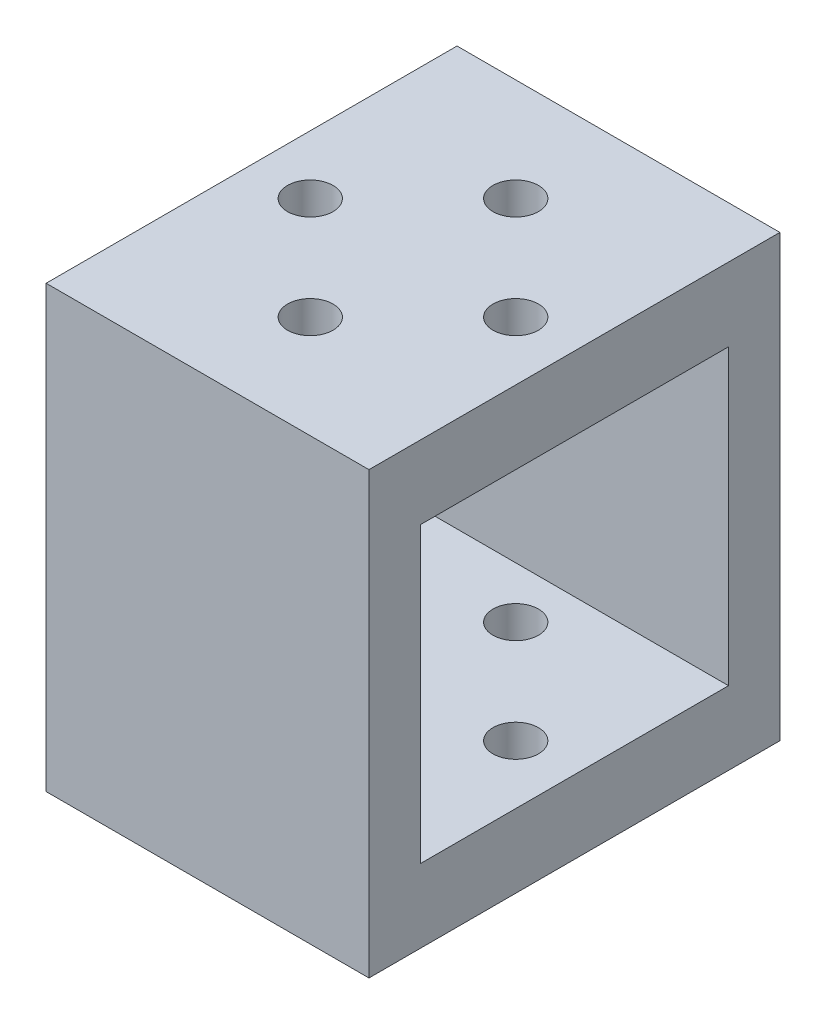
from build123d import *

# Parameters (mm, degrees)
SKETCH1_W           = 22
SKETCH1_H           = 28
BOSS_EXTRUDE1_DEPTH = 5
SKETCH2_W           = 22
SKETCH2_H           = 5
BOSS_EXTRUDE2_DEPTH = 20
SKETCH3_W           = 22
SKETCH3_H           = 28
BOSS_EXTRUDE3_DEPTH = 5
SKETCH4_R           = 1.55
CUT_EXTRUDE1_DEPTH  = 30
SKETCH5_W           = 22
SKETCH5_H           = 20
CUT_EXTRUDE2_DEPTH  = 1.5
SKETCH6_W           = 22
SKETCH6_H           = 20
CUT_EXTRUDE3_DEPTH  = 1.5


with BuildPart() as part:
    # Sketch1 → Boss-Extrude1 (new body)
    with BuildSketch(Plane(origin=(0, 0, 0), x_dir=(1, 0, 0), z_dir=(0, 1, 0))):
        Rectangle(SKETCH1_W, SKETCH1_H)
    extrude(amount=BOSS_EXTRUDE1_DEPTH)

    # Sketch2 → Boss-Extrude2 (add)
    with BuildSketch(Plane(origin=(0, 5, 0), x_dir=(1, 0, 0), z_dir=(0, 1, 0))):
        with Locations((0, -11.5)):
            Rectangle(SKETCH2_W, SKETCH2_H)
        with Locations((0, 11.5)):
            Rectangle(SKETCH2_W, SKETCH2_H)
    extrude(amount=BOSS_EXTRUDE2_DEPTH)

    # Sketch3 → Boss-Extrude3 (add)
    with BuildSketch(Plane(origin=(0, 25, 0), x_dir=(1, 0, 0), z_dir=(0, 1, 0))):
        Rectangle(SKETCH3_W, SKETCH3_H)
    extrude(amount=BOSS_EXTRUDE3_DEPTH)

    # Sketch4 → Cut-Extrude1 (cut)
    with BuildSketch(Plane(origin=(0, 30, 0), x_dir=(1, 0, 0), z_dir=(0, 1, 0))):
        with Locations(Location((0, 7, 0), (0, 0, 270))):
            Circle(SKETCH4_R)
        with Locations(Location((7, 0, 0), (0, 0, 270))):
            Circle(SKETCH4_R)
        with Locations(Location((0, -7, 0), (0, 0, 270))):
            Circle(SKETCH4_R)
        with Locations(Location((-7, 0, 0), (0, 0, 270))):
            Circle(SKETCH4_R)
    extrude(amount=-CUT_EXTRUDE1_DEPTH, mode=Mode.SUBTRACT)

    # Sketch5 → Cut-Extrude2 (cut)
    with BuildSketch(Plane.XY.offset(-9)):
        with Locations((0, 15)):
            Rectangle(SKETCH5_W, SKETCH5_H)
    extrude(amount=-CUT_EXTRUDE2_DEPTH, mode=Mode.SUBTRACT)

    # Sketch6 → Cut-Extrude3 (cut)
    with BuildSketch(Plane(origin=(0, 0, 9), x_dir=(-1, 0, 0), z_dir=(0, 0, -1))):
        with Locations((0, 15)):
            Rectangle(SKETCH6_W, SKETCH6_H)
    extrude(amount=-CUT_EXTRUDE3_DEPTH, mode=Mode.SUBTRACT)


solid = part.part
